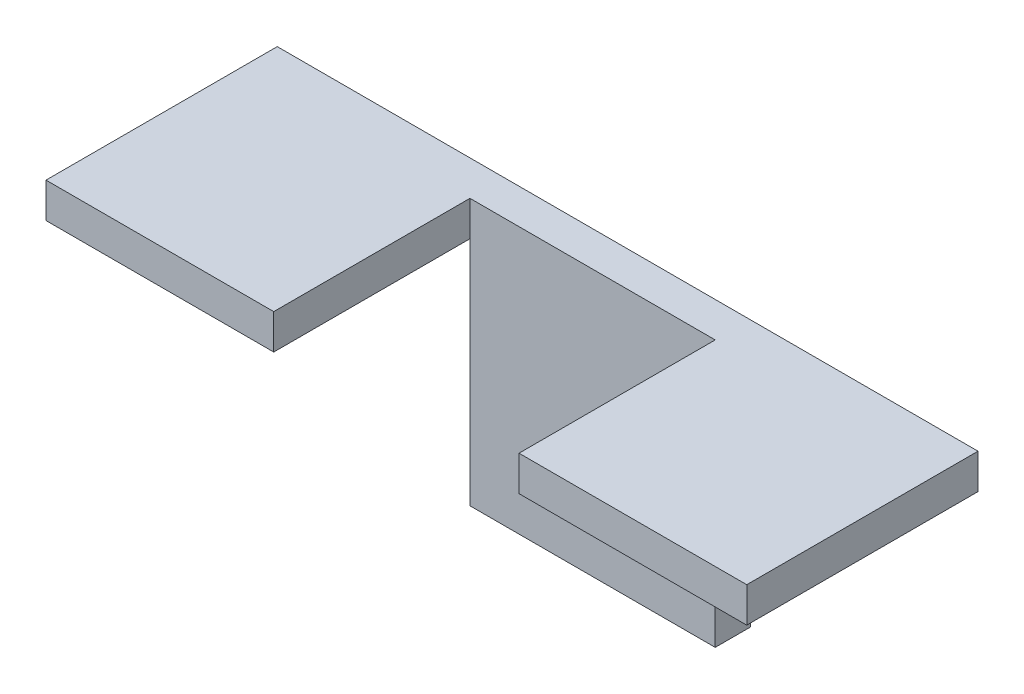
from build123d import *

# Parameters (mm, degrees)
SKETCH1_W             = 24.765
SKETCH1_H             = 25.146
BOSS_EXTRUDE1_DEPTH   = 3.81
BOSS_EXTRUDE1_2_DEPTH = 3.81
SKETCH2_W             = 26.67
SKETCH2_H             = 3.81
BOSS_EXTRUDE2_DEPTH   = 28.956


with BuildPart() as part:
    # Sketch1 → Boss-Extrude1 (new body)
    with BuildSketch(Plane(origin=(0, 0, 0), x_dir=(1, 0, 0), z_dir=(0, 1, 0))):
        with Locations((12.3825, -12.573)):
            Rectangle(SKETCH1_W, SKETCH1_H)
    extrude(amount=BOSS_EXTRUDE1_DEPTH)



with BuildPart() as body_2:
    # Sketch1 → Boss-Extrude1 2 (new body)
    with BuildSketch(Plane(origin=(0, 0, 0), x_dir=(1, 0, 0), z_dir=(0, 1, 0))):
        with Locations((63.8175, -12.573)):
            Rectangle(SKETCH1_W, SKETCH1_H)
    extrude(amount=BOSS_EXTRUDE1_2_DEPTH)


with BuildPart() as part_1:
    add(part.part)

    add(body_2.part)  # Boss-Extrude2 merges body 2
    # Sketch2 → Boss-Extrude2 (add)
    with BuildSketch(Plane(origin=(0, 3.81, 0), x_dir=(1, 0, 0), z_dir=(0, 1, 0))):
        with Locations((38.1, -1.905)):
            Rectangle(SKETCH2_W, SKETCH2_H)
    extrude(amount=-BOSS_EXTRUDE2_DEPTH)


solid = part_1.part
